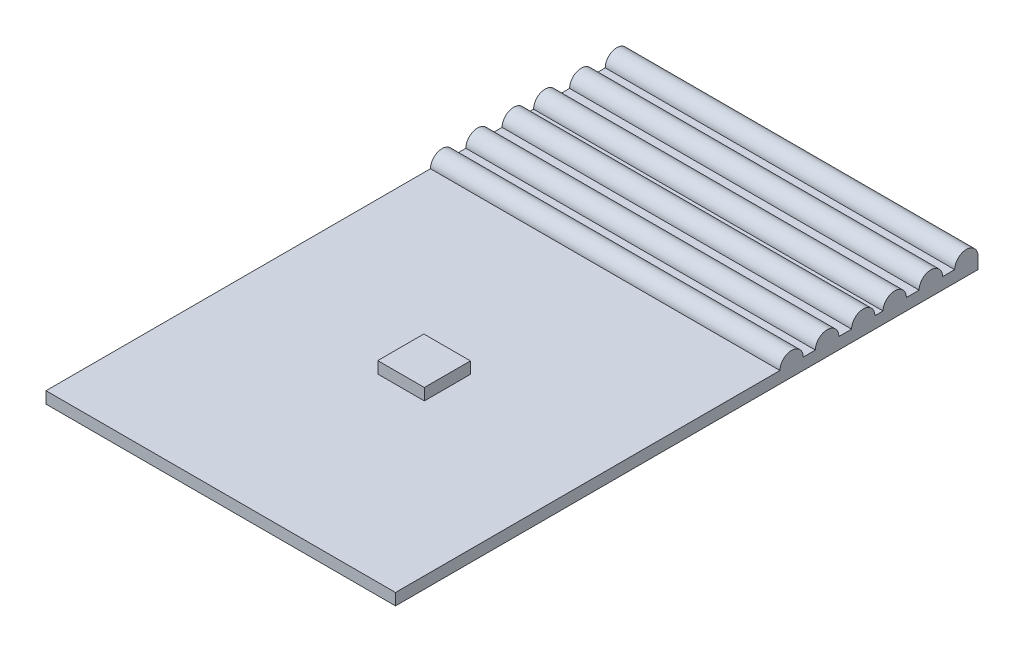
from build123d import *

# Parameters (mm, degrees)
SKETCH1_W           = 30
SKETCH1_H           = 50
BOSS_EXTRUDE1_DEPTH = 1
BOSS_EXTRUDE2_DEPTH = 30
BOSS_EXTRUDE3_DEPTH = 30
BOSS_EXTRUDE5_DEPTH = 30
SKETCH8_W           = 4
SKETCH8_H           = 3.954682566
BOSS_EXTRUDE6_DEPTH = 1


with BuildPart() as part:
    # Sketch1 → Boss-Extrude1 (new body)
    with BuildSketch(Plane(origin=(0, 0, 0), x_dir=(1, 0, 0), z_dir=(0, 1, 0))):
        with Locations((15, 25)):
            Rectangle(SKETCH1_W, SKETCH1_H)
    extrude(amount=BOSS_EXTRUDE1_DEPTH)

    # Sketch3 → Boss-Extrude2 (add)
    with BuildSketch(Plane.ZY):
        with BuildLine():
            Line((-50, 1), (-48, 1))
            ThreePointArc((-48, 1), (-49, 2), (-50, 1))
        make_face()
    boss_extrude2 = extrude(amount=-BOSS_EXTRUDE2_DEPTH)

    # Sketch5 → Boss-Extrude3 (add)
    with BuildSketch(Plane.ZY):
        with BuildLine():
            Line((-46.960567447, 1), (-44.946165632, 1))
            ThreePointArc((-44.946165632, 1), (-45.953366539, 2.007200908), (-46.960567447, 1))
        make_face()
    boss_extrude3 = extrude(amount=-BOSS_EXTRUDE3_DEPTH)

    # Sketch7 → Boss-Extrude5 (add)
    with BuildSketch(Plane.ZY):
        with BuildLine():
            Line((-43.851141388, 1), (-41.851141388, 1))
            ThreePointArc((-41.851141388, 1), (-42.851141388, 2), (-43.851141388, 1))
        make_face()
    boss_extrude5 = extrude(amount=-BOSS_EXTRUDE5_DEPTH)

    # Mirror1: Boss-Extrude2, Boss-Extrude3, Boss-Extrude5 across plane
    add(boss_extrude2.mirror(Plane(origin=(0, 0, -41.5), x_dir=(1, 0, 0), z_dir=(0, 0, -1))))
    add(boss_extrude3.mirror(Plane(origin=(0, 0, -41.5), x_dir=(1, 0, 0), z_dir=(0, 0, -1))))
    add(boss_extrude5.mirror(Plane(origin=(0, 0, -41.5), x_dir=(1, 0, 0), z_dir=(0, 0, -1))))

    # Sketch8 → Boss-Extrude6 (add)
    with BuildSketch(Plane(origin=(0, 1, 0), x_dir=(1, 0, 0), z_dir=(0, 1, 0))):
        with Locations((15, 17.453820001)):
            Rectangle(SKETCH8_W, SKETCH8_H)
    extrude(amount=BOSS_EXTRUDE6_DEPTH)


solid = part.part
